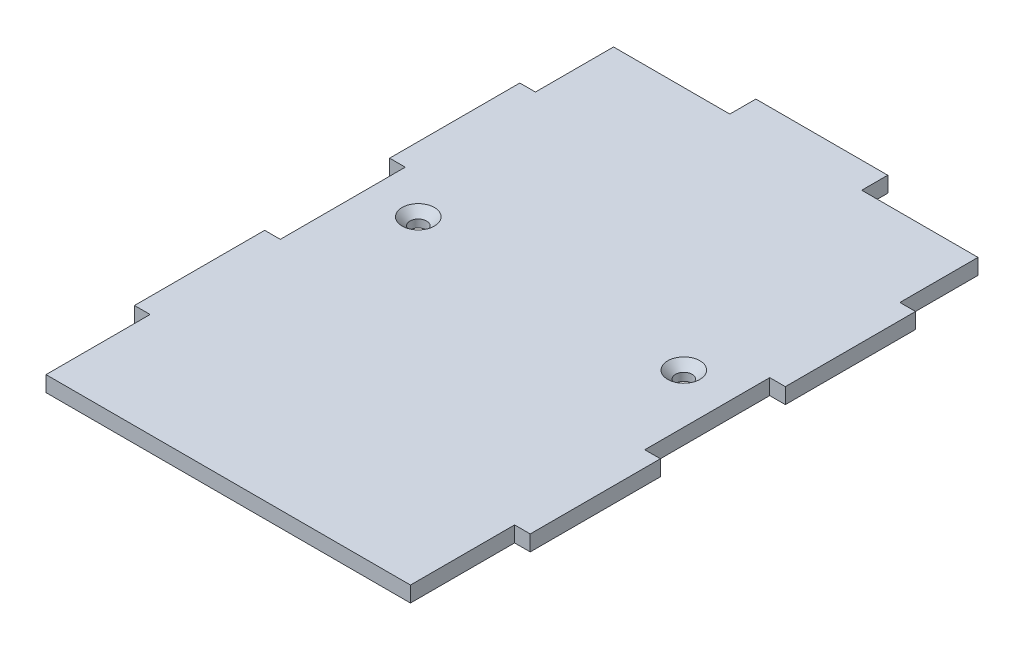
from build123d import *

# Parameters (mm, degrees)
BOSS_EXTRUDE1_DEPTH = 3
SKETCH2_R           = 1.6
CUT_EXTRUDE1_DEPTH  = 69.571130952
CHAMFER1_SIZE       = 1.5


with BuildPart() as part:
    # Sketch1 → Boss-Extrude1 (new body)
    with BuildSketch(Plane(origin=(0, 0, 0), x_dir=(1, 0, 0), z_dir=(0, 1, 0))):
        Polygon((0, -57), (-35, -57), (-35, -37), (-38, -37), (-38, -12), (-35, -12), (-35, 12), (-38, 12), (-38, 37), (-35, 37), (-35, 52), (-12.666666667, 52), (-12.666666667, 57), (0, 57), align=None)
    boss_extrude1 = extrude(amount=BOSS_EXTRUDE1_DEPTH)

    # Mirror1: Boss-Extrude1 across plane
    add(boss_extrude1.mirror(Plane(origin=(0, 3, -57), x_dir=(0, 0, 1), z_dir=(-1, 0, 0))))

    # Sketch2 → Cut-Extrude1 (cut, through all)
    with BuildSketch(Plane(origin=(0, 3, 0), x_dir=(1, 0, 0), z_dir=(0, 1, 0))):
        with Locations(Location((-25.5, 5, 0), (0, 0, 270))):
            Circle(SKETCH2_R)
        with Locations(Location((25.5, 5, 0), (0, 0, 270))):
            Circle(SKETCH2_R)
    extrude(amount=-CUT_EXTRUDE1_DEPTH, mode=Mode.SUBTRACT)

    # Chamfer1
    chamfer1_edges = [part.edges().sort_by_distance(p)[0] for p in [
        (-25.5, 3, -6.6),
        (25.5, 3, -6.6),
    ]]
    chamfer(chamfer1_edges, length=CHAMFER1_SIZE)


solid = part.part
